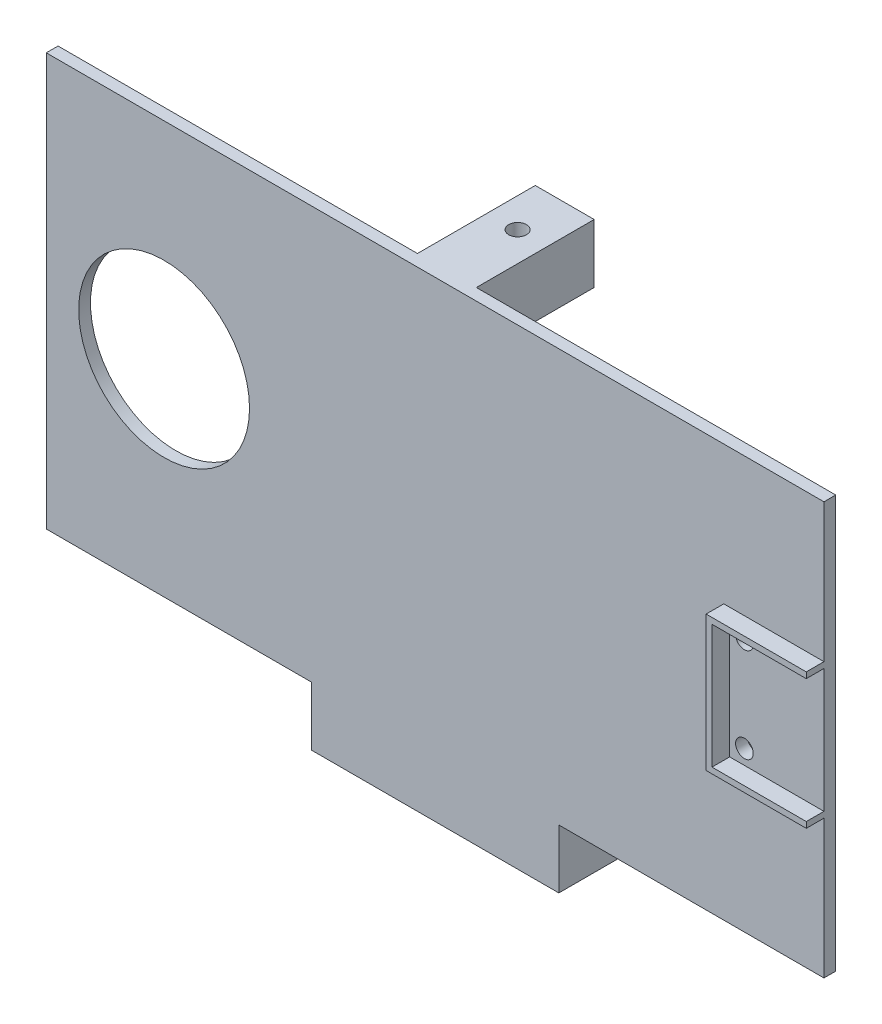
from build123d import *

# Parameters (mm, degrees)
BOSS_EXTRUDE1_DEPTH = 2
SKETCH2_R           = 14.5
CUT_EXTRUDE1_DEPTH  = 2
BOSS_EXTRUDE2_DEPTH = 3
CUT_EXTRUDE2_REACH  = 81.937
SKETCH5_R           = 1.5
SKETCH6_W           = 10
SKETCH6_H           = 10
BOSS_EXTRUDE3_DEPTH = 20
SKETCH10_W          = 42
SKETCH10_H          = 20
BOSS_EXTRUDE5_DEPTH = 20
CUT_EXTRUDE3_DEPTH  = 6
CUT_EXTRUDE4_REACH  = 107.622
SKETCH12_R          = 1.5


with BuildPart() as part:
    # Sketch1 → Boss-Extrude1 (new body)
    with BuildSketch(Plane.XY):
        Polygon((21, -35), (66, -35), (66, 35), (-66, 35), (-66, -35), (-21, -35), (-21, -45), (21, -45), align=None)
    extrude(amount=BOSS_EXTRUDE1_DEPTH)

    # Sketch2 → Cut-Extrude1 (cut)
    with BuildSketch(Plane.XY.offset(2)):
        with Locations((-46, 0)):
            Circle(SKETCH2_R)
    extrude(amount=-CUT_EXTRUDE1_DEPTH, mode=Mode.SUBTRACT)

    # Sketch3 → Boss-Extrude2 (add)
    with BuildSketch(Plane.XY.offset(2)):
        Polygon((50, -10.5), (50, 10.5), (66, 10.5), (66, 11.5), (49, 11.5), (49, -11.5), (66, -11.5), (66, -10.5), align=None)
    extrude(amount=BOSS_EXTRUDE2_DEPTH)

    # Sketch5 → Cut-Extrude2 (cut, up to next)
    with BuildSketch(Plane.XY.offset(2), mode=Mode.PRIVATE) as cut_extrude2_sk1:
        with Locations((52.5, 8)):
            Circle(SKETCH5_R)
    cut_extrude2_tool1 = extrude(cut_extrude2_sk1.sketch, amount=-CUT_EXTRUDE2_REACH, mode=Mode.PRIVATE) & part.part
    # Sketch5 → Cut-Extrude2 (cut, up to next)
    with BuildSketch(Plane.XY.offset(2), mode=Mode.PRIVATE) as cut_extrude2_sk2:
        with Locations((52.5, -8)):
            Circle(SKETCH5_R)
    cut_extrude2_tool2 = extrude(cut_extrude2_sk2.sketch, amount=-CUT_EXTRUDE2_REACH, mode=Mode.PRIVATE) & part.part
    add(cut_extrude2_tool1.solids().sort_by_distance((52.5, 8, 2))[0], mode=Mode.SUBTRACT)
    add(cut_extrude2_tool2.solids().sort_by_distance((52.5, -8, 2))[0], mode=Mode.SUBTRACT)

    # Sketch6 → Boss-Extrude3 (add)
    with BuildSketch(Plane(origin=(0, 0, 0), x_dir=(-1, 0, 0), z_dir=(0, 0, -1))):
        with Locations((0, 30)):
            Rectangle(SKETCH6_W, SKETCH6_H)
    extrude(amount=BOSS_EXTRUDE3_DEPTH)

    # Sketch10 → Boss-Extrude5 (add)
    with BuildSketch(Plane(origin=(0, 0, 0), x_dir=(-1, 0, 0), z_dir=(0, 0, -1))):
        with Locations((0, -35)):
            Rectangle(SKETCH10_W, SKETCH10_H)
    extrude(amount=BOSS_EXTRUDE5_DEPTH)

    # Sketch11 → Cut-Extrude3 (cut)
    with BuildSketch(Plane.XZ.offset(45)):
        with BuildLine():
            Line((-3.932248681, -7.468176933), (-16.408317349, -9.533589408))
            ThreePointArc((-16.408317349, -9.533589408), (-18.5, -12.000023193), (-16.408309881, -14.466450643))
            Line((-16.408309881, -14.466450643), (-3.932248681, -16.531823067))
            ThreePointArc((-3.932248681, -16.531823067), (0, -18), (3.932248681, -16.531823067))
            Line((3.932248681, -16.531823067), (16.408313615, -14.466430618))
            ThreePointArc((16.408313615, -14.466430618), (18.5, -12), (16.408313615, -9.533569382))
            Line((16.408313615, -9.533569382), (3.932248681, -7.468176933))
            ThreePointArc((3.932248681, -7.468176933), (0, -6), (-3.932248681, -7.468176933))
        make_face()
    extrude(amount=-CUT_EXTRUDE3_DEPTH, mode=Mode.SUBTRACT)

    # Sketch12 → Cut-Extrude4 (cut, up to next)
    with BuildSketch(Plane(origin=(0, 35, 0), x_dir=(1, 0, 0), z_dir=(0, 1, 0)), mode=Mode.PRIVATE) as cut_extrude4_sk1:
        with Locations(Location((0, 12, 0), (0, 0, 270))):
            Circle(SKETCH12_R)
    cut_extrude4_tool1 = extrude(cut_extrude4_sk1.sketch, amount=-CUT_EXTRUDE4_REACH, mode=Mode.PRIVATE) & part.part
    add(cut_extrude4_tool1.solids().sort_by_distance((0, 35, -12))[0], mode=Mode.SUBTRACT)


solid = part.part
